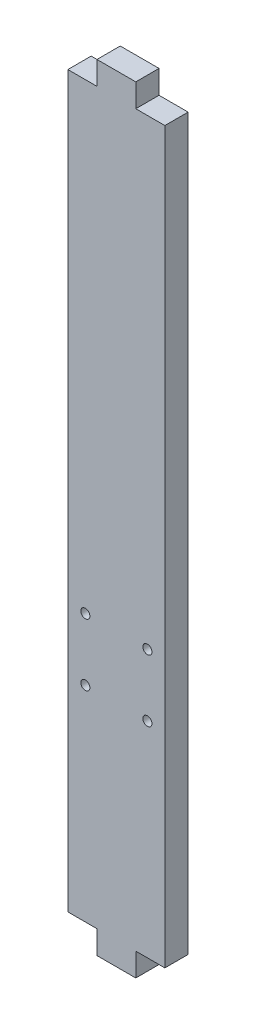
from build123d import *

# Parameters (mm, degrees)
ESQUISSE1_W             = 25
ESQUISSE1_H             = 200
BOSS_EXTRU_1_DEPTH      = 6
ESQUISSE2_R             = 1.175
ENL_V_MAT_EXTRU_1_DEPTH = 6
ESQUISSE3_W             = 7.5
ESQUISSE3_H             = 6
ENL_V_MAT_EXTRU_2_DEPTH = 6


with BuildPart() as part:
    # Esquisse1 → Boss.-Extru.1 (new body)
    with BuildSketch(Plane.XY):
        Rectangle(ESQUISSE1_W, ESQUISSE1_H)
    extrude(amount=BOSS_EXTRU_1_DEPTH)

    # Esquisse2 → Enlèv. mat.-Extru.1 (cut)
    with BuildSketch(Plane.XY.offset(6)):
        with Locations((8, -41.15)):
            Circle(ESQUISSE2_R)
        with Locations((-8, -41.15)):
            Circle(ESQUISSE2_R)
        with Locations((-8, -25.15)):
            Circle(ESQUISSE2_R)
        with Locations((8, -25.15)):
            Circle(ESQUISSE2_R)
    extrude(amount=-ENL_V_MAT_EXTRU_1_DEPTH, mode=Mode.SUBTRACT)

    # Esquisse3 → Enlèv. mat.-Extru.2 (cut)
    with BuildSketch(Plane.XY.offset(6)):
        with Locations((-8.75, -97)):
            Rectangle(ESQUISSE3_W, ESQUISSE3_H)
        with Locations((8.75, -97)):
            Rectangle(ESQUISSE3_W, ESQUISSE3_H)
        with Locations((8.75, 97)):
            Rectangle(ESQUISSE3_W, ESQUISSE3_H)
        with Locations((-8.75, 97)):
            Rectangle(ESQUISSE3_W, ESQUISSE3_H)
    extrude(amount=-ENL_V_MAT_EXTRU_2_DEPTH, mode=Mode.SUBTRACT)


solid = part.part
